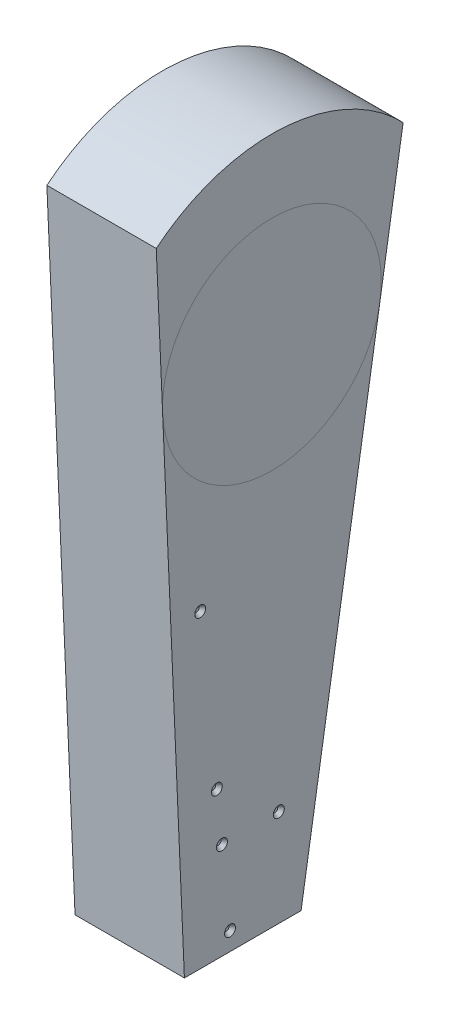
from build123d import *

# Parameters (mm, degrees)
SALIENTE_EXTRUIR1_DEPTH         = 76.2
CROQUIS4_R                      = 3.81
CORTAR_EXTRUIR1_DEPTH           = 2.54
CORTAR_EXTRUIR1_DRAFT           = -39
CORTAR_EXTRUIR1_PROFILE_2_DEPTH = 2.54
CORTAR_EXTRUIR1_PROFILE_2_DRAFT = -39
CORTAR_EXTRUIR1_PROFILE_3_DEPTH = 2.54
CORTAR_EXTRUIR1_PROFILE_3_DRAFT = -39
CORTAR_EXTRUIR1_PROFILE_4_DEPTH = 2.54
CORTAR_EXTRUIR1_PROFILE_4_DRAFT = -39
CORTAR_EXTRUIR1_PROFILE_5_DEPTH = 2.54
CORTAR_EXTRUIR1_PROFILE_5_DRAFT = -39
CORTAR_EXTRUIR1_PROFILE_6_DEPTH = 2.54
CORTAR_EXTRUIR1_PROFILE_6_DRAFT = -39
CROQUIS5_R                      = 3.81
CORTAR_EXTRUIR2_DEPTH           = 2.54
CORTAR_EXTRUIR2_DRAFT           = -39
CORTAR_EXTRUIR2_PROFILE_2_DEPTH = 2.54
CORTAR_EXTRUIR2_PROFILE_2_DRAFT = -39
CORTAR_EXTRUIR2_PROFILE_3_DEPTH = 2.54
CORTAR_EXTRUIR2_PROFILE_3_DRAFT = -39
CORTAR_EXTRUIR2_PROFILE_4_DEPTH = 2.54
CORTAR_EXTRUIR2_PROFILE_4_DRAFT = -39
CORTAR_EXTRUIR2_PROFILE_5_DEPTH = 2.54
CORTAR_EXTRUIR2_PROFILE_5_DRAFT = -39
CORTAR_EXTRUIR2_PROFILE_6_DEPTH = 2.54
CORTAR_EXTRUIR2_PROFILE_6_DRAFT = -39
CORTAR_EXTRUIR2_PROFILE_7_DEPTH = 2.54
CORTAR_EXTRUIR2_PROFILE_7_DRAFT = -39
CORTAR_EXTRUIR2_PROFILE_8_DEPTH = 2.54
CORTAR_EXTRUIR2_PROFILE_8_DRAFT = -39
CORTAR_EXTRUIR2_PROFILE_9_DEPTH = 2.54
CORTAR_EXTRUIR2_PROFILE_9_DRAFT = -39


with BuildPart() as part:
    # Croquis1 → Saliente-Extruir1 (new body)
    with BuildSketch(Plane(origin=(0, 0, 0), x_dir=(0, 0, -1), z_dir=(1, 0, 0))):
        with BuildLine():
            Line((-60.94000004, -351.79000001), (-80.551642675, 98.185705998))
            ThreePointArc((-80.551642675, 98.185705998), (7.403499257, 126.784021859), (91.432215779, 88.142781427))
            Line((91.432215779, 88.142781427), (20.33999996, -351.79000001))
            Line((20.33999996, -351.79000001), (-60.94000004, -351.79000001))
        make_face()
    extrude(amount=SALIENTE_EXTRUIR1_DEPTH)


with BuildPart() as cortar_extruir1_tool:
    # Croquis4 → Cortar-Extruir1 (with draft: the straight prism first)
    with BuildSketch(Plane(origin=(76.2, 0, 0), x_dir=(0, 0, -1), z_dir=(1, 0, 0))):
        with Locations((-49.917099877, -136.126844727)):
            Circle(CROQUIS4_R)
    extrude(amount=-CORTAR_EXTRUIR1_DEPTH)
    # Cortar-Extruir1: the draft: its side faces are tilted about the plane it starts from
    cortar_extruir1_sides = [cortar_extruir1_tool.faces().sort_by_distance(p)[0] for p in [
        (74.93, -136.126844727, 53.727099877),
    ]]
    draft(cortar_extruir1_sides, Plane(origin=(76.2, 0, 0), x_dir=(0, 0, -1), z_dir=(1, 0, 0)), CORTAR_EXTRUIR1_DRAFT)


with BuildPart() as part_1:
    add(part.part)

    # Cortar-Extruir1: cut by cortar_extruir1_tool
    add(cortar_extruir1_tool.part, mode=Mode.SUBTRACT)


with BuildPart() as cortar_extruir1_profile_2_tool:
    # Croquis4 → Cortar-Extruir1 profile 2 (with draft: the straight prism first)
    with BuildSketch(Plane(origin=(76.2, 0, 0), x_dir=(0, 0, -1), z_dir=(1, 0, 0))):
        with Locations((-38.362373799, -249.174001321)):
            Circle(CROQUIS4_R)
    extrude(amount=-CORTAR_EXTRUIR1_PROFILE_2_DEPTH)
    # Cortar-Extruir1 profile 2: the draft: its side faces are tilted about the plane it starts from
    cortar_extruir1_profile_2_sides = [cortar_extruir1_profile_2_tool.faces().sort_by_distance(p)[0] for p in [
        (74.93, -249.174001321, 42.172373799),
    ]]
    draft(cortar_extruir1_profile_2_sides, Plane(origin=(76.2, 0, 0), x_dir=(0, 0, -1), z_dir=(1, 0, 0)), CORTAR_EXTRUIR1_PROFILE_2_DRAFT)


with BuildPart() as part_2:
    add(part_1.part)

    # Cortar-Extruir1 profile 2: cut by cortar_extruir1_profile_2_tool
    add(cortar_extruir1_profile_2_tool.part, mode=Mode.SUBTRACT)


with BuildPart() as cortar_extruir1_profile_3_tool:
    # Croquis4 → Cortar-Extruir1 profile 3 (with draft: the straight prism first)
    with BuildSketch(Plane(origin=(76.2, 0, 0), x_dir=(0, 0, -1), z_dir=(1, 0, 0))):
        with Locations((-34.768096531, -284.339077712)):
            Circle(CROQUIS4_R)
    extrude(amount=-CORTAR_EXTRUIR1_PROFILE_3_DEPTH)
    # Cortar-Extruir1 profile 3: the draft: its side faces are tilted about the plane it starts from
    cortar_extruir1_profile_3_sides = [cortar_extruir1_profile_3_tool.faces().sort_by_distance(p)[0] for p in [
        (74.93, -284.339077712, 38.578096531),
    ]]
    draft(cortar_extruir1_profile_3_sides, Plane(origin=(76.2, 0, 0), x_dir=(0, 0, -1), z_dir=(1, 0, 0)), CORTAR_EXTRUIR1_PROFILE_3_DRAFT)


with BuildPart() as part_3:
    add(part_2.part)

    # Cortar-Extruir1 profile 3: cut by cortar_extruir1_profile_3_tool
    add(cortar_extruir1_profile_3_tool.part, mode=Mode.SUBTRACT)


with BuildPart() as cortar_extruir1_profile_4_tool:
    # Croquis4 → Cortar-Extruir1 profile 4 (with draft: the straight prism first)
    with BuildSketch(Plane(origin=(76.2, 0, 0), x_dir=(0, 0, -1), z_dir=(1, 0, 0))):
        with Locations((-29.171919425, -339.09000001)):
            Circle(CROQUIS4_R)
    extrude(amount=-CORTAR_EXTRUIR1_PROFILE_4_DEPTH)
    # Cortar-Extruir1 profile 4: the draft: its side faces are tilted about the plane it starts from
    cortar_extruir1_profile_4_sides = [cortar_extruir1_profile_4_tool.faces().sort_by_distance(p)[0] for p in [
        (74.93, -339.09000001, 32.981919425),
    ]]
    draft(cortar_extruir1_profile_4_sides, Plane(origin=(76.2, 0, 0), x_dir=(0, 0, -1), z_dir=(1, 0, 0)), CORTAR_EXTRUIR1_PROFILE_4_DRAFT)


with BuildPart() as part_4:
    add(part_3.part)

    # Cortar-Extruir1 profile 4: cut by cortar_extruir1_profile_4_tool
    add(cortar_extruir1_profile_4_tool.part, mode=Mode.SUBTRACT)


with BuildPart() as cortar_extruir1_profile_5_tool:
    # Croquis4 → Cortar-Extruir1 profile 5 (with draft: the straight prism first)
    with BuildSketch(Plane(origin=(76.2, 0, 0), x_dir=(0, 0, -1), z_dir=(1, 0, 0))):
        with Locations((29.171919425, -339.09000001)):
            Circle(CROQUIS4_R)
    extrude(amount=-CORTAR_EXTRUIR1_PROFILE_5_DEPTH)
    # Cortar-Extruir1 profile 5: the draft: its side faces are tilted about the plane it starts from
    cortar_extruir1_profile_5_sides = [cortar_extruir1_profile_5_tool.faces().sort_by_distance(p)[0] for p in [
        (74.93, -339.09000001, -25.361919425),
    ]]
    draft(cortar_extruir1_profile_5_sides, Plane(origin=(76.2, 0, 0), x_dir=(0, 0, -1), z_dir=(1, 0, 0)), CORTAR_EXTRUIR1_PROFILE_5_DRAFT)


with BuildPart() as part_5:
    add(part_4.part)

    # Cortar-Extruir1 profile 5: cut by cortar_extruir1_profile_5_tool
    add(cortar_extruir1_profile_5_tool.part, mode=Mode.SUBTRACT)


with BuildPart() as cortar_extruir1_profile_6_tool:
    # Croquis4 → Cortar-Extruir1 profile 6 (with draft: the straight prism first)
    with BuildSketch(Plane(origin=(76.2, 0, 0), x_dir=(0, 0, -1), z_dir=(1, 0, 0))):
        with Locations((4.819460737, -284.339077712)):
            Circle(CROQUIS4_R)
    extrude(amount=-CORTAR_EXTRUIR1_PROFILE_6_DEPTH)
    # Cortar-Extruir1 profile 6: the draft: its side faces are tilted about the plane it starts from
    cortar_extruir1_profile_6_sides = [cortar_extruir1_profile_6_tool.faces().sort_by_distance(p)[0] for p in [
        (74.93, -284.339077712, -1.009460737),
    ]]
    draft(cortar_extruir1_profile_6_sides, Plane(origin=(76.2, 0, 0), x_dir=(0, 0, -1), z_dir=(1, 0, 0)), CORTAR_EXTRUIR1_PROFILE_6_DRAFT)


with BuildPart() as part_6:
    add(part_5.part)

    # Cortar-Extruir1 profile 6: cut by cortar_extruir1_profile_6_tool
    add(cortar_extruir1_profile_6_tool.part, mode=Mode.SUBTRACT)


with BuildPart() as cortar_extruir2_tool:
    # Croquis5 → Cortar-Extruir2 (with draft: the straight prism first)
    with BuildSketch(Plane.ZY):
        with Locations((-12.556850651, -339.09000001)):
            Circle(CROQUIS5_R)
    extrude(amount=-CORTAR_EXTRUIR2_DEPTH)
    # Cortar-Extruir2: the draft: its side faces are tilted about the plane it starts from
    cortar_extruir2_sides = [cortar_extruir2_tool.faces().sort_by_distance(p)[0] for p in [
        (1.27, -339.09000001, -16.366850651),
    ]]
    draft(cortar_extruir2_sides, Plane.ZY, CORTAR_EXTRUIR2_DRAFT)


with BuildPart() as part_7:
    add(part_6.part)

    # Cortar-Extruir2: cut by cortar_extruir2_tool
    add(cortar_extruir2_tool.part, mode=Mode.SUBTRACT)


with BuildPart() as cortar_extruir2_profile_2_tool:
    # Croquis5 → Cortar-Extruir2 profile 2 (with draft: the straight prism first)
    with BuildSketch(Plane.ZY):
        with Locations((12.556850651, -339.09000001)):
            Circle(CROQUIS5_R)
    extrude(amount=-CORTAR_EXTRUIR2_PROFILE_2_DEPTH)
    # Cortar-Extruir2 profile 2: the draft: its side faces are tilted about the plane it starts from
    cortar_extruir2_profile_2_sides = [cortar_extruir2_profile_2_tool.faces().sort_by_distance(p)[0] for p in [
        (1.27, -339.09000001, 8.746850651),
    ]]
    draft(cortar_extruir2_profile_2_sides, Plane.ZY, CORTAR_EXTRUIR2_PROFILE_2_DRAFT)


with BuildPart() as part_8:
    add(part_7.part)

    # Cortar-Extruir2 profile 2: cut by cortar_extruir2_profile_2_tool
    add(cortar_extruir2_profile_2_tool.part, mode=Mode.SUBTRACT)


with BuildPart() as cortar_extruir2_profile_3_tool:
    # Croquis5 → Cortar-Extruir2 profile 3 (with draft: the straight prism first)
    with BuildSketch(Plane.ZY):
        with Locations((-34.182100121, -290.072249352)):
            Circle(CROQUIS5_R)
    extrude(amount=-CORTAR_EXTRUIR2_PROFILE_3_DEPTH)
    # Cortar-Extruir2 profile 3: the draft: its side faces are tilted about the plane it starts from
    cortar_extruir2_profile_3_sides = [cortar_extruir2_profile_3_tool.faces().sort_by_distance(p)[0] for p in [
        (1.27, -290.072249352, -37.992100121),
    ]]
    draft(cortar_extruir2_profile_3_sides, Plane.ZY, CORTAR_EXTRUIR2_PROFILE_3_DRAFT)


with BuildPart() as part_9:
    add(part_8.part)

    # Cortar-Extruir2 profile 3: cut by cortar_extruir2_profile_3_tool
    add(cortar_extruir2_profile_3_tool.part, mode=Mode.SUBTRACT)


with BuildPart() as cortar_extruir2_profile_4_tool:
    # Croquis5 → Cortar-Extruir2 profile 4 (with draft: the straight prism first)
    with BuildSketch(Plane.ZY):
        with Locations((-48.265473167, -152.285748198)):
            Circle(CROQUIS5_R)
    extrude(amount=-CORTAR_EXTRUIR2_PROFILE_4_DEPTH)
    # Cortar-Extruir2 profile 4: the draft: its side faces are tilted about the plane it starts from
    cortar_extruir2_profile_4_sides = [cortar_extruir2_profile_4_tool.faces().sort_by_distance(p)[0] for p in [
        (1.27, -152.285748198, -52.075473167),
    ]]
    draft(cortar_extruir2_profile_4_sides, Plane.ZY, CORTAR_EXTRUIR2_PROFILE_4_DRAFT)


with BuildPart() as part_10:
    add(part_9.part)

    # Cortar-Extruir2 profile 4: cut by cortar_extruir2_profile_4_tool
    add(cortar_extruir2_profile_4_tool.part, mode=Mode.SUBTRACT)


with BuildPart() as cortar_extruir2_profile_5_tool:
    # Croquis5 → Cortar-Extruir2 profile 5 (with draft: the straight prism first)
    with BuildSketch(Plane.ZY):
        with Locations((-69.751939629, 57.929874619)):
            Circle(CROQUIS5_R)
    extrude(amount=-CORTAR_EXTRUIR2_PROFILE_5_DEPTH)
    # Cortar-Extruir2 profile 5: the draft: its side faces are tilted about the plane it starts from
    cortar_extruir2_profile_5_sides = [cortar_extruir2_profile_5_tool.faces().sort_by_distance(p)[0] for p in [
        (1.27, 57.929874619, -73.561939629),
    ]]
    draft(cortar_extruir2_profile_5_sides, Plane.ZY, CORTAR_EXTRUIR2_PROFILE_5_DRAFT)


with BuildPart() as part_11:
    add(part_10.part)

    # Cortar-Extruir2 profile 5: cut by cortar_extruir2_profile_5_tool
    add(cortar_extruir2_profile_5_tool.part, mode=Mode.SUBTRACT)


with BuildPart() as cortar_extruir2_profile_6_tool:
    # Croquis5 → Cortar-Extruir2 profile 6 (with draft: the straight prism first)
    with BuildSketch(Plane.ZY):
        with Locations((-48.265473167, 103.609527072)):
            Circle(CROQUIS5_R)
    extrude(amount=-CORTAR_EXTRUIR2_PROFILE_6_DEPTH)
    # Cortar-Extruir2 profile 6: the draft: its side faces are tilted about the plane it starts from
    cortar_extruir2_profile_6_sides = [cortar_extruir2_profile_6_tool.faces().sort_by_distance(p)[0] for p in [
        (1.27, 103.609527072, -52.075473167),
    ]]
    draft(cortar_extruir2_profile_6_sides, Plane.ZY, CORTAR_EXTRUIR2_PROFILE_6_DRAFT)


with BuildPart() as part_12:
    add(part_11.part)

    # Cortar-Extruir2 profile 6: cut by cortar_extruir2_profile_6_tool
    add(cortar_extruir2_profile_6_tool.part, mode=Mode.SUBTRACT)


with BuildPart() as cortar_extruir2_profile_7_tool:
    # Croquis5 → Cortar-Extruir2 profile 7 (with draft: the straight prism first)
    with BuildSketch(Plane.ZY):
        with Locations((48.265473167, 103.609527072)):
            Circle(CROQUIS5_R)
    extrude(amount=-CORTAR_EXTRUIR2_PROFILE_7_DEPTH)
    # Cortar-Extruir2 profile 7: the draft: its side faces are tilted about the plane it starts from
    cortar_extruir2_profile_7_sides = [cortar_extruir2_profile_7_tool.faces().sort_by_distance(p)[0] for p in [
        (1.27, 103.609527072, 44.455473167),
    ]]
    draft(cortar_extruir2_profile_7_sides, Plane.ZY, CORTAR_EXTRUIR2_PROFILE_7_DRAFT)


with BuildPart() as part_13:
    add(part_12.part)

    # Cortar-Extruir2 profile 7: cut by cortar_extruir2_profile_7_tool
    add(cortar_extruir2_profile_7_tool.part, mode=Mode.SUBTRACT)


with BuildPart() as cortar_extruir2_profile_8_tool:
    # Croquis5 → Cortar-Extruir2 profile 8 (with draft: the straight prism first)
    with BuildSketch(Plane.ZY):
        with Locations((69.751939629, 57.929874619)):
            Circle(CROQUIS5_R)
    extrude(amount=-CORTAR_EXTRUIR2_PROFILE_8_DEPTH)
    # Cortar-Extruir2 profile 8: the draft: its side faces are tilted about the plane it starts from
    cortar_extruir2_profile_8_sides = [cortar_extruir2_profile_8_tool.faces().sort_by_distance(p)[0] for p in [
        (1.27, 57.929874619, 65.941939629),
    ]]
    draft(cortar_extruir2_profile_8_sides, Plane.ZY, CORTAR_EXTRUIR2_PROFILE_8_DRAFT)


with BuildPart() as part_14:
    add(part_13.part)

    # Cortar-Extruir2 profile 8: cut by cortar_extruir2_profile_8_tool
    add(cortar_extruir2_profile_8_tool.part, mode=Mode.SUBTRACT)


with BuildPart() as cortar_extruir2_profile_9_tool:
    # Croquis5 → Cortar-Extruir2 profile 9 (with draft: the straight prism first)
    with BuildSketch(Plane.ZY):
        with Locations((48.265473167, -152.285748198)):
            Circle(CROQUIS5_R)
    extrude(amount=-CORTAR_EXTRUIR2_PROFILE_9_DEPTH)
    # Cortar-Extruir2 profile 9: the draft: its side faces are tilted about the plane it starts from
    cortar_extruir2_profile_9_sides = [cortar_extruir2_profile_9_tool.faces().sort_by_distance(p)[0] for p in [
        (1.27, -152.285748198, 44.455473167),
    ]]
    draft(cortar_extruir2_profile_9_sides, Plane.ZY, CORTAR_EXTRUIR2_PROFILE_9_DRAFT)


with BuildPart() as part_15:
    add(part_14.part)

    # Cortar-Extruir2 profile 9: cut by cortar_extruir2_profile_9_tool
    add(cortar_extruir2_profile_9_tool.part, mode=Mode.SUBTRACT)


solid = part_15.part
